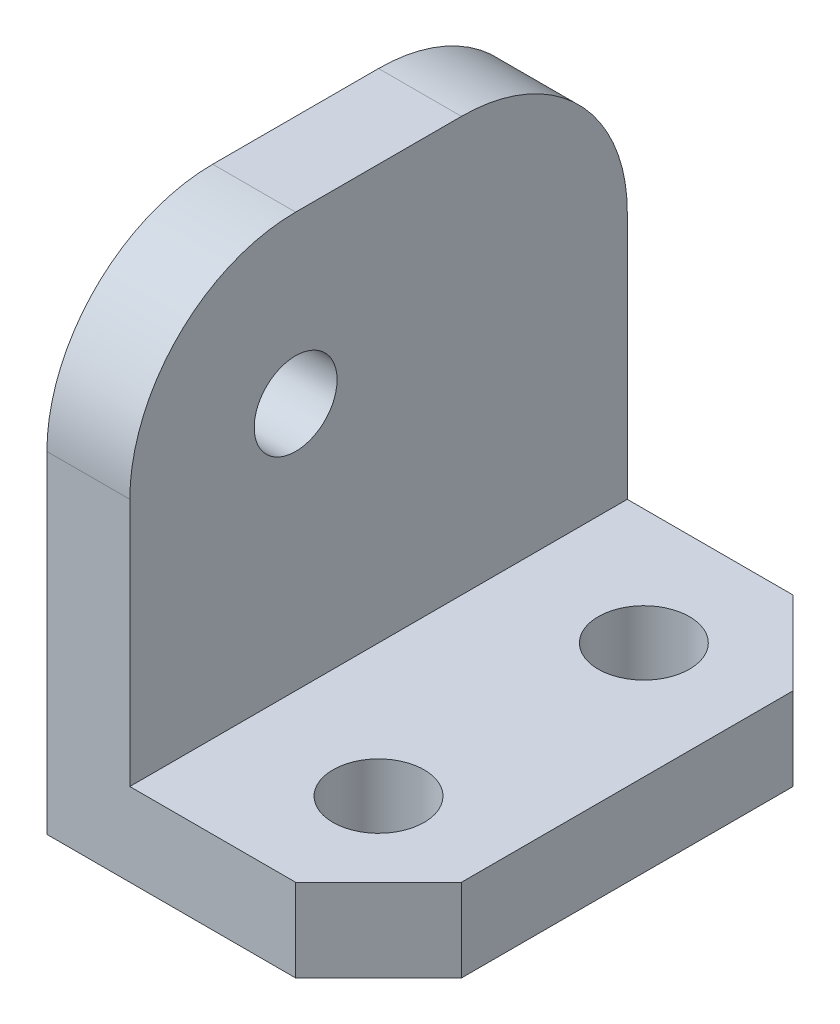
from build123d import *

# Parameters (mm, degrees)
BOSS_EXTRUDE1_DEPTH        = 30
M6_TAPPED_HOLE2_D          = 5
F_5_5_5_5_DIAMETER_HOLE1_D = 5.5
CUT_EXTRUDE1_DEPTH         = 51.68530359
FILLET3_R                  = 10
CHAMFER1_SIZE              = 5


with BuildPart() as part:
    # Sketch1 → Boss-Extrude1 (new body)
    with BuildSketch(Plane.XY):
        Polygon((0, 0), (0, 38), (5, 38), (5, 5), (20, 5), (20, 0), align=None)
    extrude(amount=BOSS_EXTRUDE1_DEPTH)

    # M6 Tapped Hole2 (through all)
    with Locations(Plane(origin=(5, 0, 0), x_dir=(0, 0, -1), z_dir=(1, 0, 0))):
        with Locations((-20, 20)):
            Hole(M6_TAPPED_HOLE2_D / 2)

    # Ø5.5 (5.5) Diameter Hole1 (through all)
    with Locations(Plane(origin=(0, 5, 0), x_dir=(1, 0, 0), z_dir=(0, 1, 0))):
        with Locations((13, -7), (13, -23)):
            Hole(F_5_5_5_5_DIAMETER_HOLE1_D / 2)

    # Sketch13 → Cut-Extrude1 (cut, through all)
    with BuildSketch(Plane(origin=(5, 0, 0), x_dir=(0, 0, -1), z_dir=(1, 0, 0))):
        with BuildLine():
            Line((-20, 30), (0, 30))
            Line((0, 30), (0, 38))
            Line((0, 38), (-30, 38))
            Line((-30, 38), (-30, 20))
            ThreePointArc((-30, 20), (-27.071067812, 27.071067812), (-20, 30))
        make_face()
    extrude(amount=-CUT_EXTRUDE1_DEPTH, mode=Mode.SUBTRACT)

    # Fillet3
    fillet3_edges = [part.edges().sort_by_distance(p)[0] for p in [
        (2.5, 30, 0),
    ]]
    fillet(fillet3_edges, radius=FILLET3_R)

    # Chamfer1
    chamfer1_edges = [part.edges().sort_by_distance(p)[0] for p in [
        (20, 2.5, 0),
        (20, 2.5, 30),
    ]]
    chamfer(chamfer1_edges, length=CHAMFER1_SIZE)


solid = part.part
